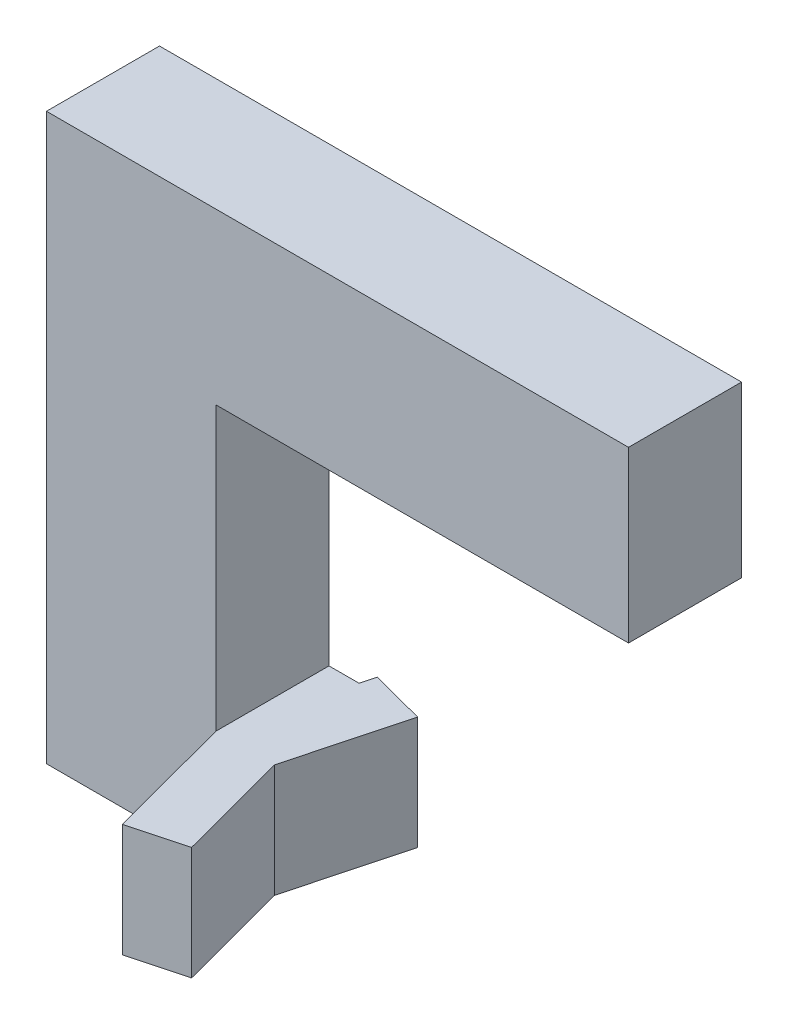
from build123d import *

# Parameters (mm, degrees)
BOSS_EXTRUDE1_DEPTH = 5
BOSS_EXTRUDE2_DEPTH = 10


with BuildPart() as part:
    # Sketch1 → Boss-Extrude1 (new, symmetric)
    with BuildSketch(Plane.XY):
        Polygon((51.5, 0), (0, 0), (0, -50), (15, -50), (15, -15), (51.5, -15), align=None)
    extrude(amount=BOSS_EXTRUDE1_DEPTH, both=True)

    # Sketch2 → Boss-Extrude2 (add)
    with BuildSketch(Plane.XZ.offset(50)):
        Polygon((22.832157544, -5), (18, -6.284621916), (15, 5), (18, 16.284621916), (22.832157544, 15), (20.173672375, 5), align=None)
        Polygon((15, -5), (17.658485169, -5), (15, 5), align=None)
        Polygon((18, 16.284621916), (15, 5), (20.173672375, 5), (22.832157544, 15), align=None)
    extrude(amount=-BOSS_EXTRUDE2_DEPTH)


solid = part.part
